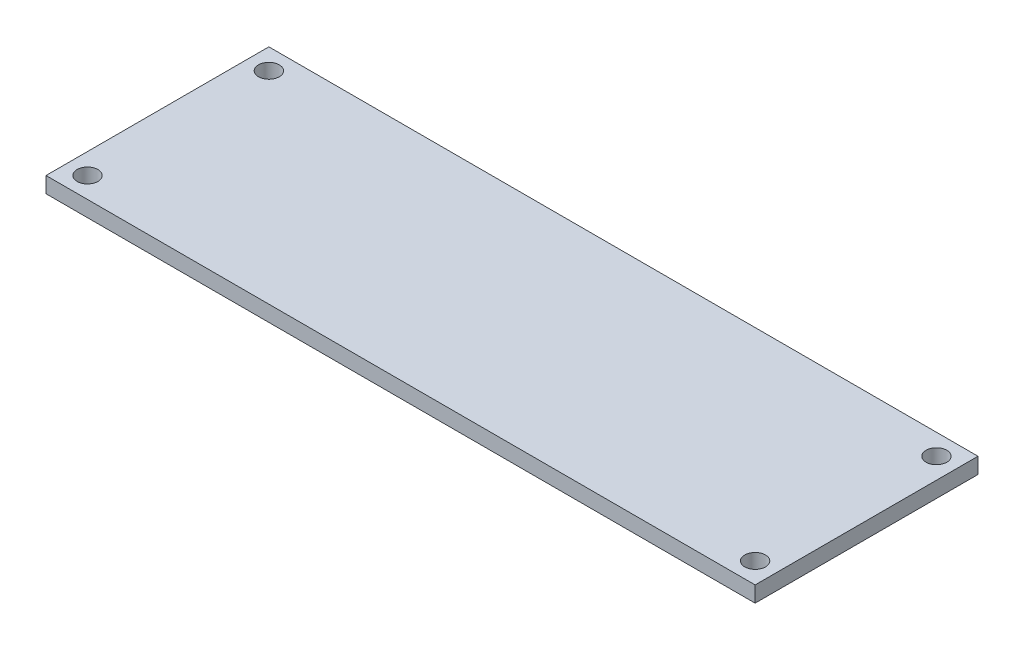
from build123d import *

# Parameters (mm, degrees)
SKETCH1_W           = 142.24
SKETCH1_H           = 44.704
BOSS_EXTRUDE1_DEPTH = 3.175
SKETCH2_R           = 2.0828
CUT_EXTRUDE1_DEPTH  = 75.617336652


with BuildPart() as part:
    # Sketch1 → Boss-Extrude1 (new body)
    with BuildSketch(Plane(origin=(0, 0, 0), x_dir=(1, 0, 0), z_dir=(0, 1, 0))):
        Rectangle(SKETCH1_W, SKETCH1_H)
    extrude(amount=BOSS_EXTRUDE1_DEPTH)

    # Sketch2 → Cut-Extrude1 (cut, through all)
    with BuildSketch(Plane(origin=(0, 3.175, 0), x_dir=(1, 0, 0), z_dir=(0, 1, 0))):
        with Locations(Location((-66.9544, 18.1864, 0), (0, 0, 270))):
            Circle(SKETCH2_R)
        with Locations(Location((-66.9544, -18.1864, 0), (0, 0, 90))):
            Circle(SKETCH2_R)
        with Locations(Location((66.9544, 18.1864, 0), (0, 0, 90))):
            Circle(SKETCH2_R)
        with Locations(Location((66.9544, -18.1864, 0), (0, 0, 270))):
            Circle(SKETCH2_R)
    extrude(amount=-CUT_EXTRUDE1_DEPTH, mode=Mode.SUBTRACT)


solid = part.part
